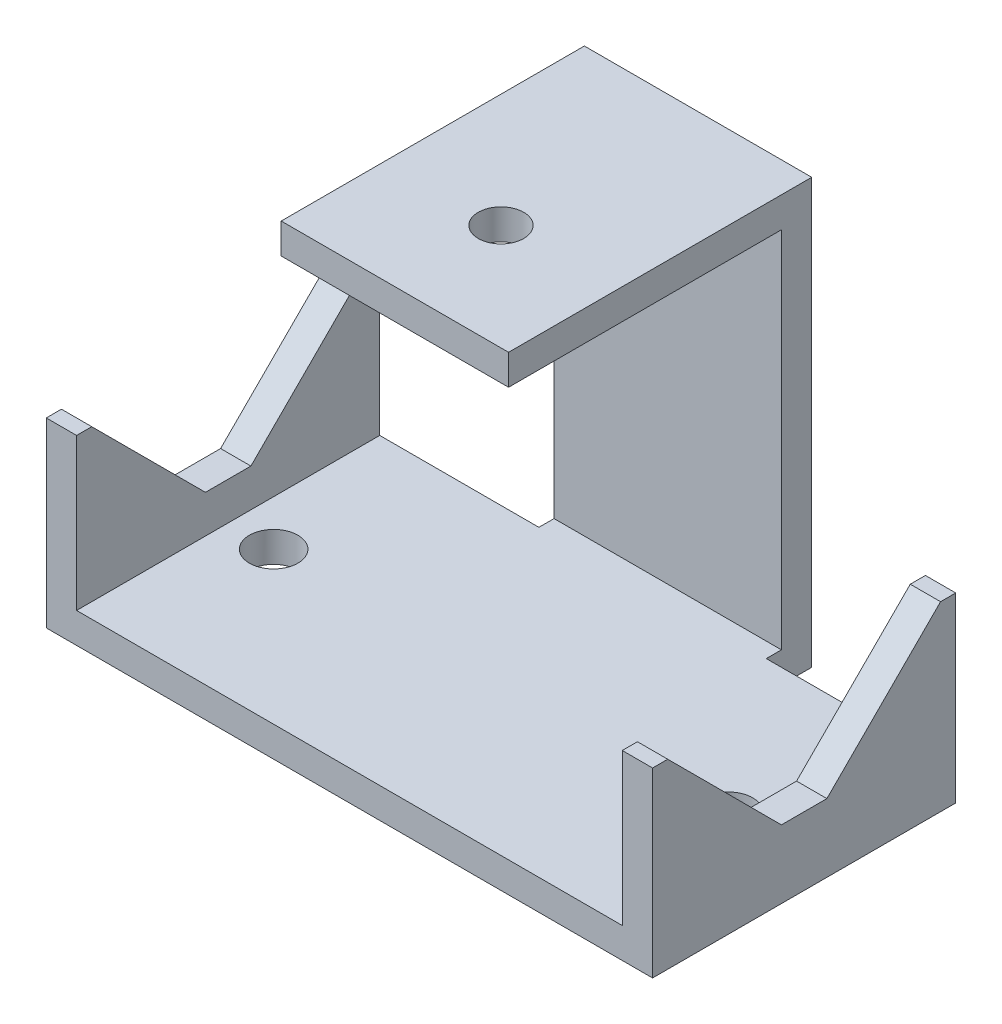
from build123d import *

# Parameters (mm, degrees)
EXTRUDE_1_DEPTH     = 2
SKETCH_2_W          = 15
SKETCH_2_H          = 28
EXTRUDE_2_DEPTH     = 2
EXTRUDE_3_DEPTH     = 2
SKETCH_4_W          = 15
SKETCH_4_H          = 20
EXTRUDE_4_DEPTH     = 2
CUT_EXTRUDE_1_REACH = 37.285
SKETCH_5_R          = 1.6
CUT_EXTRUDE_2_REACH = 38.783
SKETCH_6_R          = 1.5


with BuildPart() as part:
    # 草图1 → 凸台-拉伸1 (new body)
    with BuildSketch(Plane(origin=(0, 0, 0), x_dir=(1, 0, 0), z_dir=(0, 1, 0))):
        Polygon((7.5, 10), (20, 10), (20, -10), (-20, -10), (-20, 10), (-7.5, 10), (-7.5, 13), (7.5, 13), align=None)
    extrude(amount=EXTRUDE_1_DEPTH)

    # 草图2 → 凸台-拉伸2 (add)
    with BuildSketch(Plane(origin=(0, 0, -13), x_dir=(-1, 0, 0), z_dir=(0, 0, -1))):
        with Locations((0, 14)):
            Rectangle(SKETCH_2_W, SKETCH_2_H)
    extrude(amount=-EXTRUDE_2_DEPTH)

    # 草图3 → 凸台-拉伸3 (add)
    with BuildSketch(Plane.ZY.offset(20)):
        Polygon((1.5, 4.5), (9, 12), (10, 12), (10, 0), (-10, 0), (-10, 12), (-9, 12), (-1.5, 4.5), align=None)
    extrude_3 = extrude(amount=-EXTRUDE_3_DEPTH)

    # 镜向1: 凸台-拉伸3 across plane
    add(extrude_3.mirror(Plane(origin=(0, 0, 0), x_dir=(0, 0, 1), z_dir=(1, 0, 0))))

    # 草图4 → 凸台-拉伸4 (add)
    with BuildSketch(Plane(origin=(0, 28, 0), x_dir=(1, 0, 0), z_dir=(0, 1, 0))):
        with Locations((0, 3)):
            Rectangle(SKETCH_4_W, SKETCH_4_H)
    extrude(amount=-EXTRUDE_4_DEPTH)

    # 草图5 → 切除-拉伸1 (cut, up to next)
    with BuildSketch(Plane(origin=(0, 2, 0), x_dir=(1, 0, 0), z_dir=(0, 1, 0)), mode=Mode.PRIVATE) as cut_extrude_1_sk1:
        with Locations(Location((-15, 0, 0), (0, 0, 270))):
            Circle(SKETCH_5_R)
    cut_extrude_1_tool1 = extrude(cut_extrude_1_sk1.sketch, amount=-CUT_EXTRUDE_1_REACH, mode=Mode.PRIVATE) & part.part
    # 草图5 → 切除-拉伸1 (cut, up to next)
    with BuildSketch(Plane(origin=(0, 2, 0), x_dir=(1, 0, 0), z_dir=(0, 1, 0)), mode=Mode.PRIVATE) as cut_extrude_1_sk2:
        with Locations(Location((15, 0, 0), (0, 0, 270))):
            Circle(SKETCH_5_R)
    cut_extrude_1_tool2 = extrude(cut_extrude_1_sk2.sketch, amount=-CUT_EXTRUDE_1_REACH, mode=Mode.PRIVATE) & part.part
    add(cut_extrude_1_tool1.solids().sort_by_distance((-15, 2, 0))[0], mode=Mode.SUBTRACT)
    add(cut_extrude_1_tool2.solids().sort_by_distance((15, 2, 0))[0], mode=Mode.SUBTRACT)

    # 草图6 → 切除-拉伸2 (cut, up to next)
    with BuildSketch(Plane(origin=(0, 28, 0), x_dir=(1, 0, 0), z_dir=(0, 1, 0)), mode=Mode.PRIVATE) as cut_extrude_2_sk1:
        with Locations(Location((0, 0, 0), (0, 0, 270))):
            Circle(SKETCH_6_R)
    cut_extrude_2_tool1 = extrude(cut_extrude_2_sk1.sketch, amount=-CUT_EXTRUDE_2_REACH, mode=Mode.PRIVATE) & part.part
    add(cut_extrude_2_tool1.solids().sort_by_distance((0, 28, 0))[0], mode=Mode.SUBTRACT)


solid = part.part
